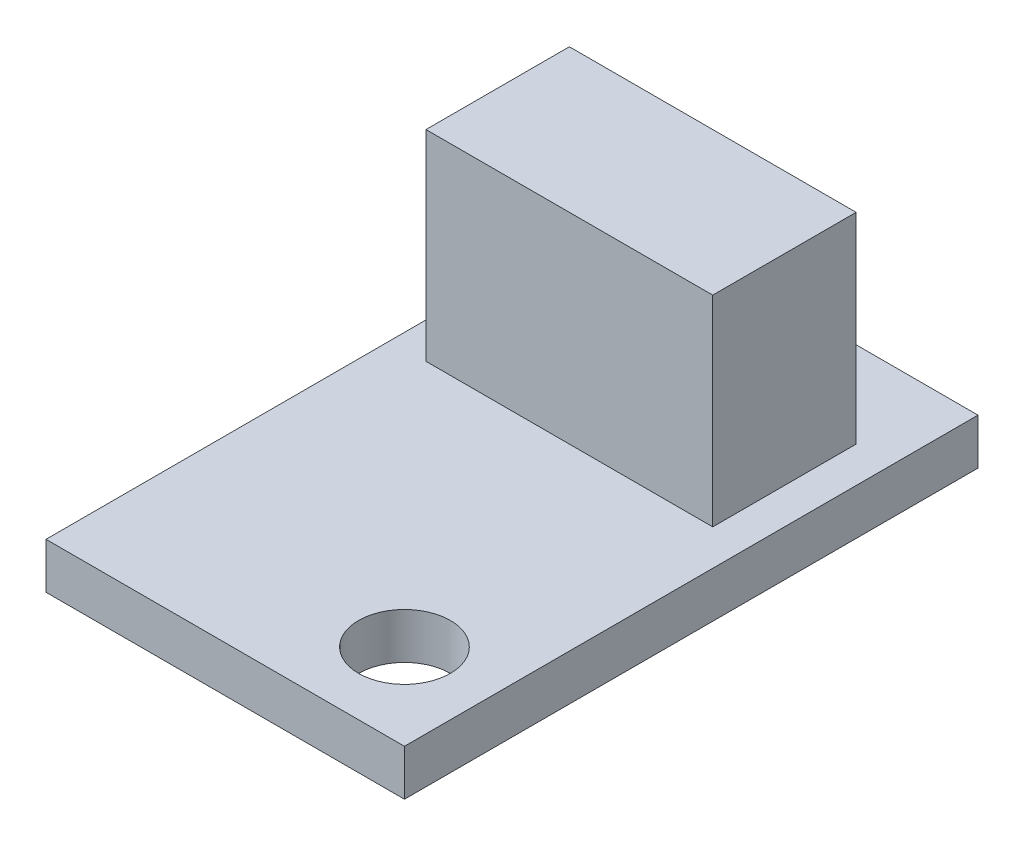
from build123d import *

# Parameters (mm, degrees)
SKETCH1_W           = 12.5
SKETCH1_H           = 20
SKETCH1_R           = 1.6
BOSS_EXTRUDE1_DEPTH = 1.6
SKETCH2_W           = 10
SKETCH2_H           = 5
BOSS_EXTRUDE2_DEPTH = 7


with BuildPart() as part:
    # Sketch1 → Boss-Extrude1 (new body)
    with BuildSketch(Plane(origin=(0, 0, 0), x_dir=(1, 0, 0), z_dir=(0, 1, 0))):
        with Locations((0, 10)):
            Rectangle(SKETCH1_W, SKETCH1_H)
        with Locations(Location((3.25, 3, 0), (0, 0, 270))):
            Circle(SKETCH1_R, mode=Mode.SUBTRACT)
    extrude(amount=BOSS_EXTRUDE1_DEPTH)

    # Sketch2 → Boss-Extrude2 (add)
    with BuildSketch(Plane(origin=(0, 1.6, 0), x_dir=(1, 0, 0), z_dir=(0, 1, 0))):
        with Locations((0, 14.5)):
            Rectangle(SKETCH2_W, SKETCH2_H)
    extrude(amount=BOSS_EXTRUDE2_DEPTH)


solid = part.part
